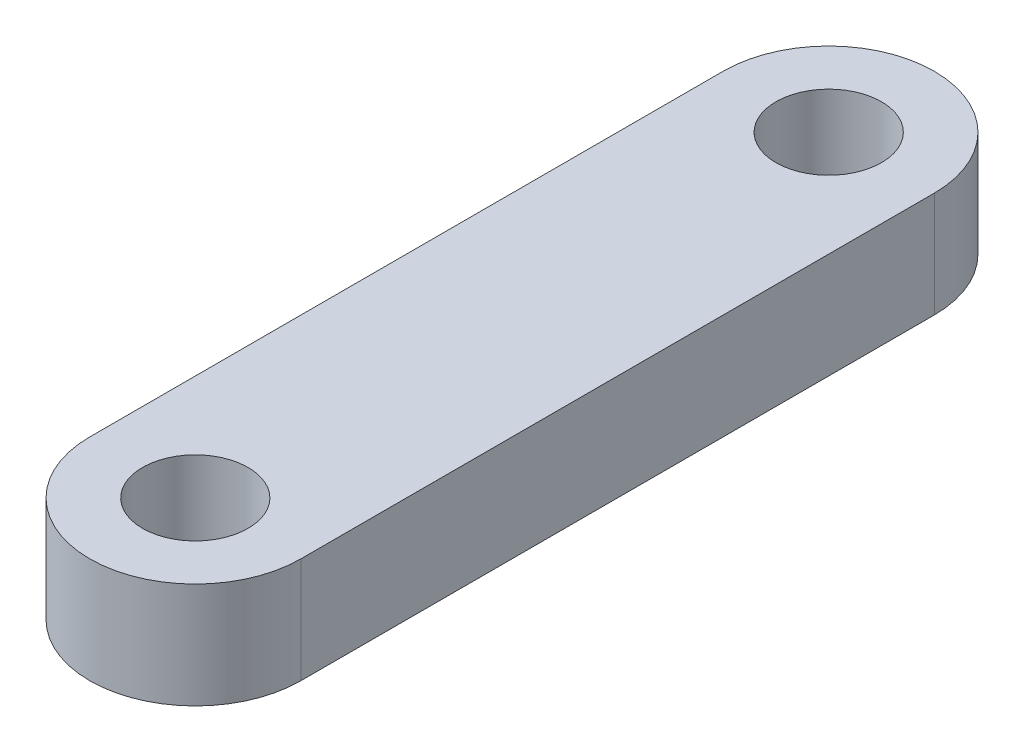
from build123d import *

# Parameters (mm, degrees)
SKETCH1_R           = 1.5875
BOSS_EXTRUDE1_DEPTH = 3.175


with BuildPart() as part:
    # Sketch1 → Boss-Extrude1 (new body)
    with BuildSketch(Plane(origin=(0, 0, 0), x_dir=(1, 0, 0), z_dir=(0, 1, 0))):
        with BuildLine():
            Line((-3.175, 0), (-3.175, 19.05))
            ThreePointArc((-3.175, 19.05), (0, 22.225), (3.175, 19.05))
            Line((3.175, 19.05), (3.175, 0))
            ThreePointArc((3.175, 0), (0, -3.175), (-3.175, 0))
        make_face()
        with Locations(Location((0, 19.05, 0), (0, 0, 270))):
            Circle(SKETCH1_R, mode=Mode.SUBTRACT)
        with Locations(Location((0, 0, 0), (0, 0, 270))):
            Circle(SKETCH1_R, mode=Mode.SUBTRACT)
    extrude(amount=BOSS_EXTRUDE1_DEPTH)


solid = part.part
